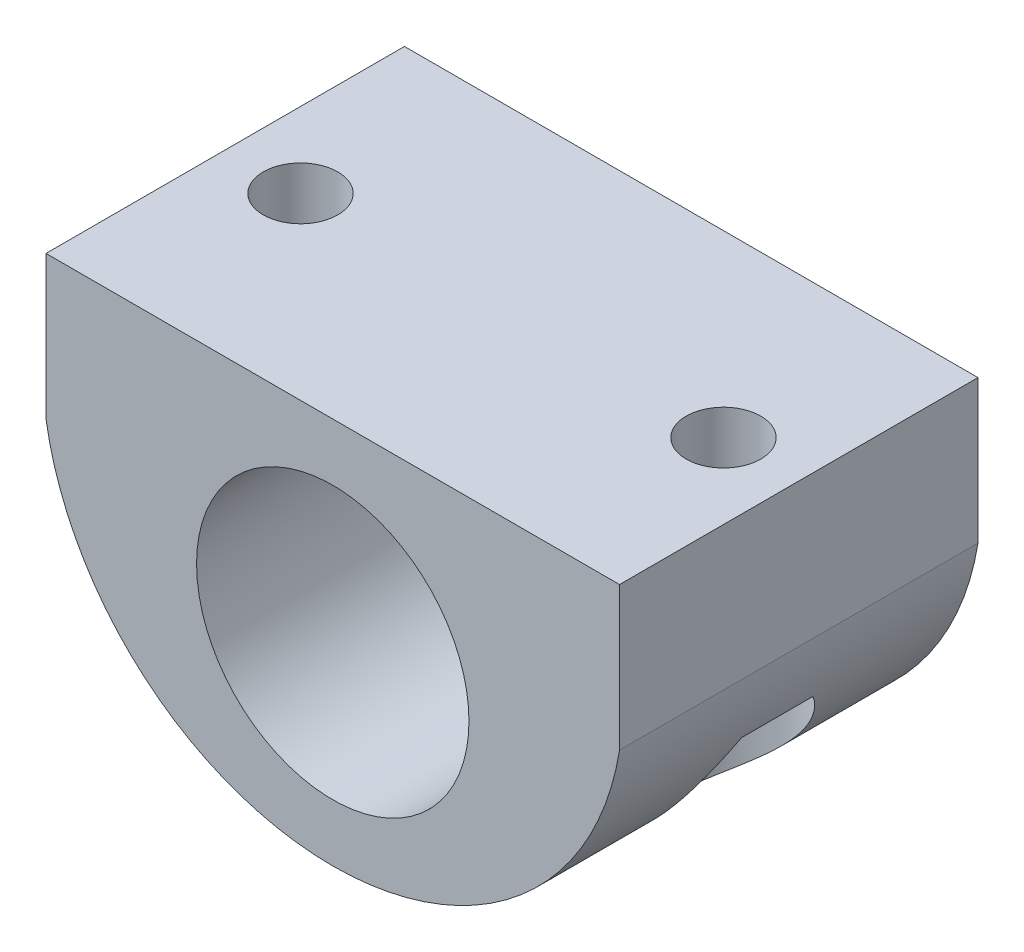
from build123d import *

# Parameters (mm, degrees)
CROQUIS1_R                 = 9.5
SALIENTE_EXTRUIR1_DEPTH    = 25
SALIENTE_EXTRUIR2_DEPTH    = 3
CORTAR_EXTRUIR1_DEPTH      = 42.880783183
CORTAR_EXTRUIR1_DEPTH_BACK = 200
CROQUIS3_R                 = 2.6
CROQUIS4_R                 = 4.5
CORTAR_EXTRUIR2_DEPTH      = 10
CORTAR_EXTRUIR3_DEPTH      = 10
CORTAR_EXTRUIR3_DEPTH_BACK = 10
CROQUIS5_R                 = 2
CORTAR_EXTRUIR4_DEPTH      = 0.5
CORTAR_EXTRUIR4_DEPTH_BACK = 10.5
CROQUIS6_R                 = 4.5


with BuildPart() as part:
    # Croquis1 → Saliente-Extruir1 (new body)
    with BuildSketch(Plane.XY):
        with BuildLine():
            Line((0, 13.5), (-20, 13.5))
            Line((-20, 13.5), (-20, 3.5))
            ThreePointArc((-20, 3.5), (-13.124404748, -8.675770292), (0, -13.5))
            ThreePointArc((0, -13.5), (13.124404748, -8.675770292), (20, 3.5))
            Line((20, 3.5), (20, 13.5))
            Line((20, 13.5), (0, 13.5))
        make_face()
        Circle(CROQUIS1_R, mode=Mode.SUBTRACT)
    extrude(amount=SALIENTE_EXTRUIR1_DEPTH)

    # Croquis2 → Saliente-Extruir2 (add)
    with BuildSketch(Plane(origin=(0, 0, 0), x_dir=(-1, 0, 0), z_dir=(0, 0, -1))):
        with BuildLine():
            Line((20, 13.5), (-20, 13.5))
            Line((-20, 13.5), (-20, 3.5))
            ThreePointArc((-20, 3.5), (0, -13.5), (20, 3.5))
            Line((20, 3.5), (20, 13.5))
        make_face()
    extrude(amount=-SALIENTE_EXTRUIR2_DEPTH)

    # Croquis3 → Cortar-Extruir1 (cut, two sides: drawn at the far end of the back side and taken through both)
    with BuildSketch(Plane(origin=(0, 13.5, 0), x_dir=(1, 0, 0), z_dir=(0, 1, 0)).offset(-CORTAR_EXTRUIR1_DEPTH_BACK)):
        with Locations((14.75, -12.5)):
            Circle(CROQUIS3_R)
        with Locations((-14.75, -12.5)):
            Circle(CROQUIS3_R)
    extrude(amount=CORTAR_EXTRUIR1_DEPTH + CORTAR_EXTRUIR1_DEPTH_BACK, mode=Mode.SUBTRACT)

    # Croquis4 → Cortar-Extruir2 (cut)
    with BuildSketch(Plane(origin=(0, -11.5, 0), x_dir=(1, 0, 0), z_dir=(0, 1, 0))):
        with Locations((-14.75, -12.5)):
            Circle(CROQUIS4_R)
        with Locations((14.75, -12.5)):
            Circle(CROQUIS4_R)
    extrude(amount=CORTAR_EXTRUIR2_DEPTH, mode=Mode.SUBTRACT)

    # Croquis5 → Cortar-Extruir3 (cut, two sides: drawn at the far end of the back side and taken through both)
    with BuildSketch(Plane(origin=(0, -11.5, 0), x_dir=(1, 0, 0), z_dir=(0, 1, 0)).offset(-CORTAR_EXTRUIR3_DEPTH_BACK)):
        with Locations((0, -12.5)):
            Circle(CROQUIS5_R)
    extrude(amount=CORTAR_EXTRUIR3_DEPTH + CORTAR_EXTRUIR3_DEPTH_BACK, mode=Mode.SUBTRACT)

    # Croquis6 → Cortar-Extruir4 (cut, two sides: drawn at the far end of the back side and taken through both)
    with BuildSketch(Plane(origin=(0, -11.5, 0), x_dir=(1, 0, 0), z_dir=(0, 1, 0)).offset(-CORTAR_EXTRUIR4_DEPTH_BACK)):
        with Locations((0, -12.5)):
            Circle(CROQUIS6_R)
    extrude(amount=CORTAR_EXTRUIR4_DEPTH + CORTAR_EXTRUIR4_DEPTH_BACK, mode=Mode.SUBTRACT)


solid = part.part
